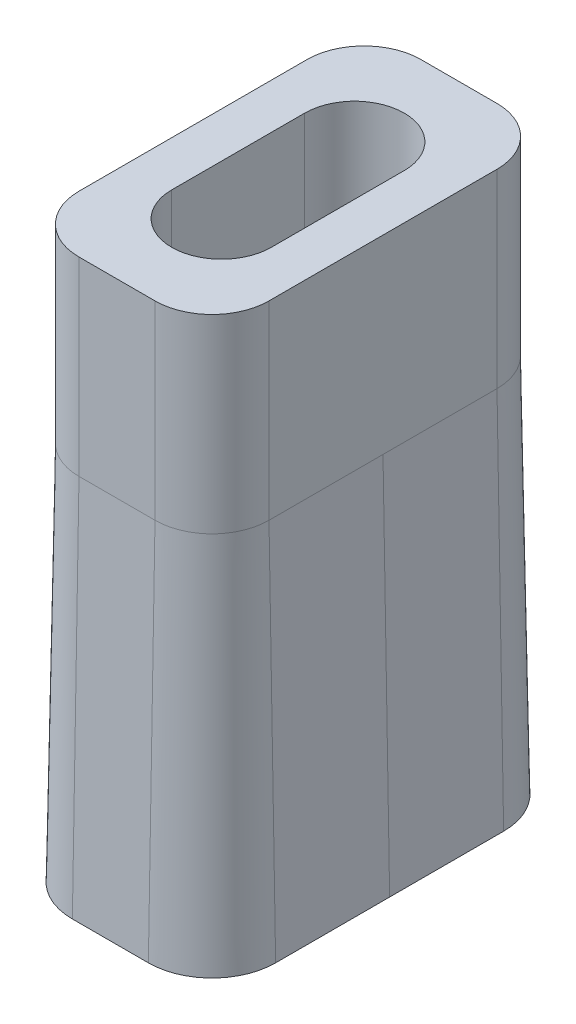
from build123d import *

# Parameters (mm, degrees)
BOSS_EXTRUDE1_DEPTH = 30
CUT_EXTRUDE2_REACH  = 33.718


with BuildPart() as part:
    # Sketch1 → Boss-Extrude1 (new body)
    with BuildSketch(Plane(origin=(0, 0, 0), x_dir=(1, 0, 0), z_dir=(0, 1, 0))):
        with BuildLine():
            Line((-2, -9), (2, -9))
            ThreePointArc((2, -9), (4.121320344, -8.121320344), (5, -6))
            Line((5, -6), (5, 6))
            ThreePointArc((5, 6), (4.121320344, 8.121320344), (2, 9))
            Line((2, 9), (-2, 9))
            ThreePointArc((-2, 9), (-4.121320344, 8.121320344), (-5, 6))
            Line((-5, 6), (-5, -6))
            ThreePointArc((-5, -6), (-4.121320344, -8.121320344), (-2, -9))
        make_face()
    extrude(amount=-BOSS_EXTRUDE1_DEPTH)

    # Sketch5 → Cut-Extrude2 (cut, up to next)
    with BuildSketch(Plane(origin=(0, 0, 0), x_dir=(1, 0, 0), z_dir=(0, 1, 0)), mode=Mode.PRIVATE) as cut_extrude2_sk1:
        with BuildLine():
            Line((-2.62, -3.5), (-2.62, 3.5))
            ThreePointArc((-2.62, 3.5), (0, 6.12), (2.62, 3.5))
            Line((2.62, 3.5), (2.62, -3.5))
            ThreePointArc((2.62, -3.5), (0, -6.12), (-2.62, -3.5))
        make_face()
    cut_extrude2_tool1 = extrude(cut_extrude2_sk1.sketch, amount=-CUT_EXTRUDE2_REACH, mode=Mode.PRIVATE) & part.part
    add(cut_extrude2_tool1.solids().sort_by_distance((0, 0, 0))[0], mode=Mode.SUBTRACT)

    # Sweep1: sweep along a path in Sketch1<3>
    with BuildLine(Plane(origin=(0, 0, 0), x_dir=(1, 0, 0), z_dir=(0, 1, 0))) as sweep1_path:
        Line((-2, -9), (2, -9))
        ThreePointArc((2, -9), (4.121320344, -8.121320344), (5, -6))
        Line((5, -6), (5, 6))
        ThreePointArc((5, 6), (4.121320344, 8.121320344), (2, 9))
        Line((2, 9), (-2, 9))
        ThreePointArc((-2, 9), (-4.121320344, 8.121320344), (-5, 6))
        Line((-5, 6), (-5, -6))
        ThreePointArc((-5, -6), (-4.121320344, -8.121320344), (-2, -9))
    # Sketch6 → Sweep1 (sweep)
    with BuildSketch(Plane.XY):
        Polygon((5, -10), (5.349101299, -30), (5, -30), align=None)
    sweep(path=sweep1_path.line)


solid = part.part
